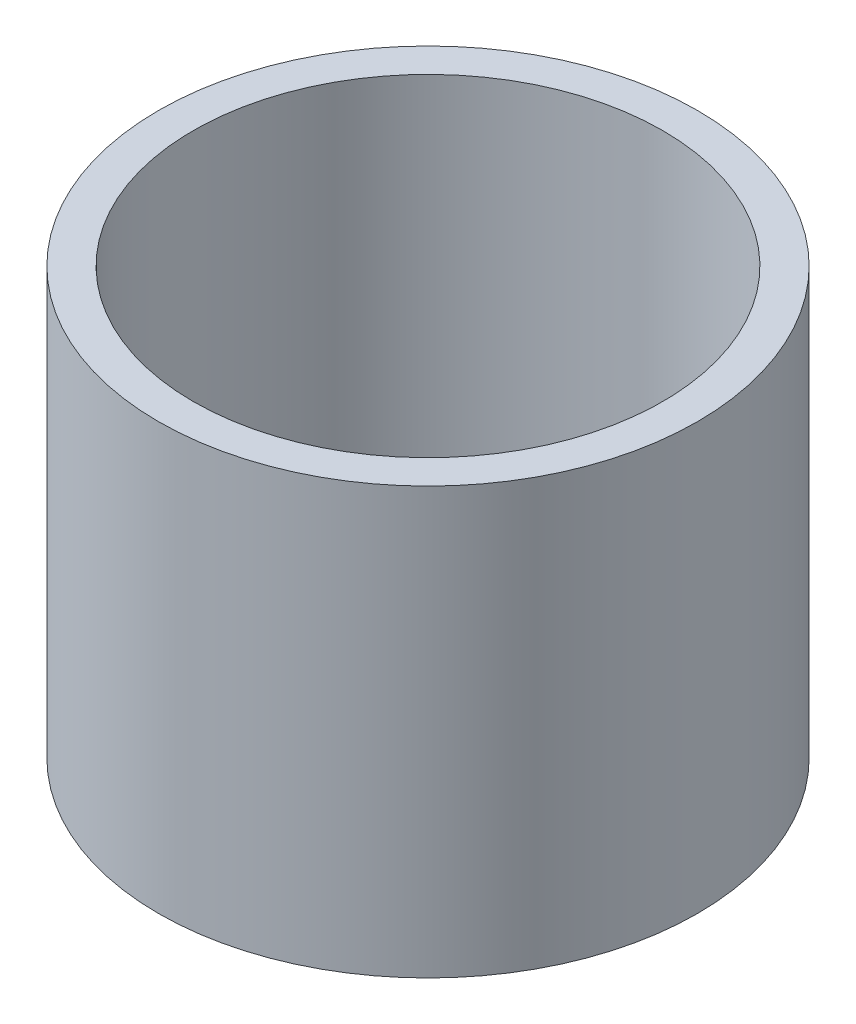
from build123d import *

# Parameters (mm, degrees)
SKETCH1_R           = 155
SKETCH1_R_2         = 135
BOSS_EXTRUDE1_DEPTH = 245


with BuildPart() as part:
    # Sketch1 → Boss-Extrude1 (new body)
    with BuildSketch(Plane(origin=(0, 0, 0), x_dir=(1, 0, 0), z_dir=(0, 1, 0))):
        with Locations(Location((0, 0, 0), (0, 0, 270))):
            Circle(SKETCH1_R)
        with Locations(Location((0, 0, 0), (0, 0, 270))):
            Circle(SKETCH1_R_2, mode=Mode.SUBTRACT)
    extrude(amount=BOSS_EXTRUDE1_DEPTH)


solid = part.part
